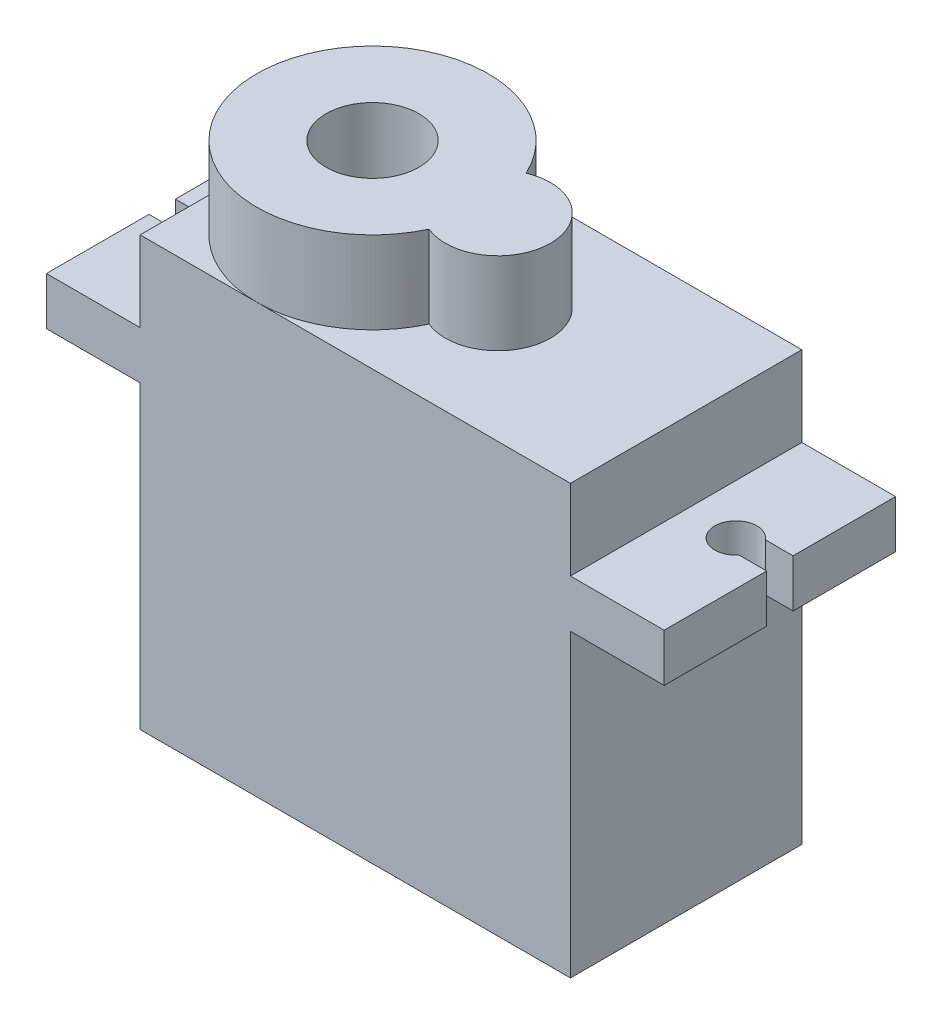
from build123d import *

# Parameters (mm, degrees)
SKETCH1_W           = 45
SKETCH1_H           = 24.2
BOSS_EXTRUDE1_DEPTH = 44.8
SKETCH2_W           = 24.2
SKETCH2_H           = 5
BOSS_EXTRUDE2_DEPTH = 9.8
CUT_EXTRUDE1_DEPTH  = 51.146385712
SKETCH4_R           = 4.86
BOSS_EXTRUDE3_DEPTH = 8.6
SKETCH5_R           = 1.5
CUT_EXTRUDE2_DEPTH  = 3


with BuildPart() as part:
    # Sketch1 → Boss-Extrude1 (new body)
    with BuildSketch(Plane(origin=(0, 0, 0), x_dir=(1, 0, 0), z_dir=(0, 1, 0))):
        Rectangle(SKETCH1_W, SKETCH1_H)
    extrude(amount=BOSS_EXTRUDE1_DEPTH)

    # Sketch2 → Boss-Extrude2 (add)
    with BuildSketch(Plane.ZY.offset(22.5)):
        with Locations((0, 33.9)):
            Rectangle(SKETCH2_W, SKETCH2_H)
    boss_extrude2 = extrude(amount=BOSS_EXTRUDE2_DEPTH)

    # Sketch3 → Cut-Extrude1 (cut, symmetric)
    with BuildSketch(Plane(origin=(0, 36.4, 0), x_dir=(1, 0, 0), z_dir=(0, 1, 0))):
        with BuildLine():
            Line((-29.412527121, 1.381032534), (-32.3, 1.381032534))
            Line((-32.3, 1.381032534), (-32.3, -1.381032534))
            Line((-32.3, -1.381032534), (-29.412527121, -1.381032534))
            ThreePointArc((-29.412527121, -1.381032534), (-25.5, 0), (-29.412527121, 1.381032534))
        make_face()
    cut_extrude1 = extrude(amount=CUT_EXTRUDE1_DEPTH, both=True, mode=Mode.SUBTRACT)

    # Mirror2: Boss-Extrude2, Cut-Extrude1 across plane
    add(boss_extrude2.mirror(Plane.ZY))
    add(cut_extrude1.mirror(Plane.ZY), mode=Mode.SUBTRACT)

    # Sketch4 → Boss-Extrude3 (add)
    with BuildSketch(Plane(origin=(0, 44.8, 0), x_dir=(1, 0, 0), z_dir=(0, 1, 0))):
        with BuildLine():
            ThreePointArc((0.686331497, 5.070554234), (-22.4, 0), (0.686331497, -5.070554234))
            ThreePointArc((0.686331497, -5.070554234), (8.316936989, 0), (0.686331497, 5.070554234))
        make_face()
        with Locations(Location((-10.3, 0, 0), (0, 0, 90))):
            Circle(SKETCH4_R, mode=Mode.SUBTRACT)
    extrude(amount=BOSS_EXTRUDE3_DEPTH)

    # Sketch5 → Cut-Extrude2 (cut)
    with BuildSketch(Plane.XZ):
        with Locations(Location((-20.5, 10.1, 0), (0, 0, 270))):
            Circle(SKETCH5_R)
        with Locations(Location((20.5, 10.1, 0), (0, 0, 270))):
            Circle(SKETCH5_R)
        with Locations(Location((20.5, -10.1, 0), (0, 0, 270))):
            Circle(SKETCH5_R)
        with Locations(Location((-20.5, -10.1, 0), (0, 0, 270))):
            Circle(SKETCH5_R)
    extrude(amount=-CUT_EXTRUDE2_DEPTH, mode=Mode.SUBTRACT)


solid = part.part
